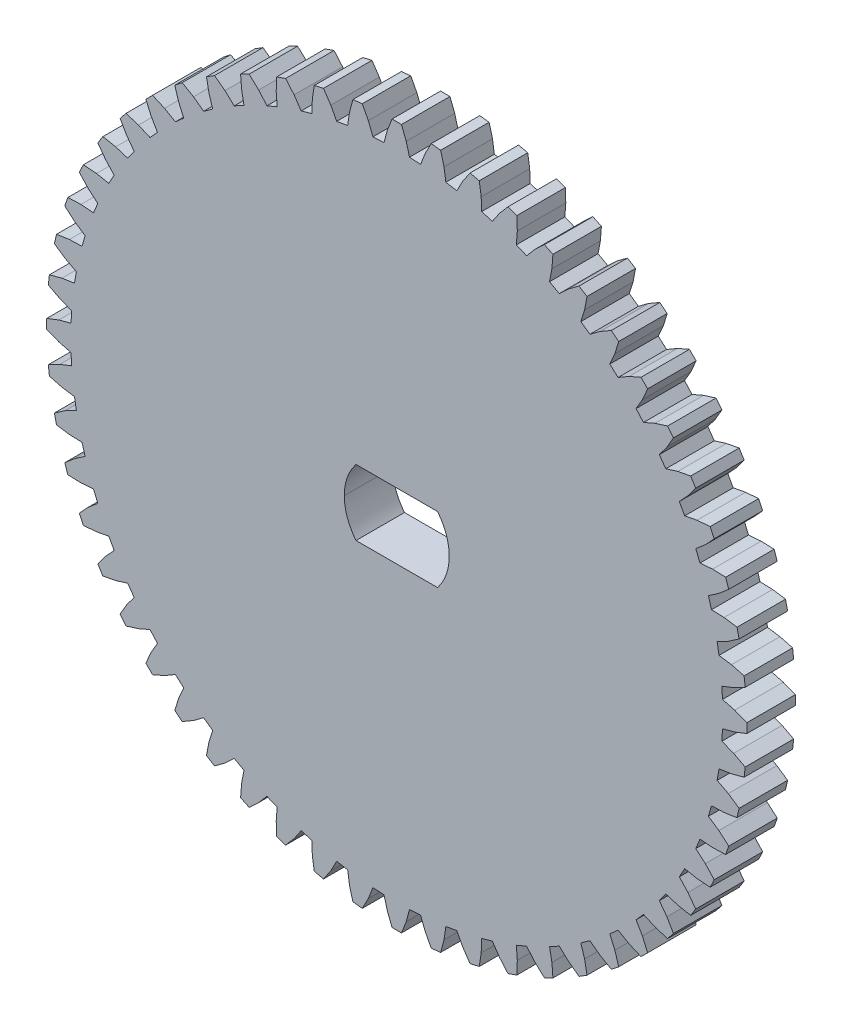
from build123d import *

# Parameters (mm, degrees)
BOSS_EXTRUDE1_DEPTH = 3.175


with BuildPart() as part:
    # Model → Boss-Extrude1 (new body)
    with BuildSketch(Plane.XY):
        Polygon((76.096077, 96.406065), (75.297953, 96.61745), (75.257031, 97.346148), (76.026368, 97.645585), (76.783571, 98.044648), (76.714426, 98.659045), (75.887233, 98.879461), (75.070482, 99.000252), (74.94828, 99.719637), (75.679517, 100.103459), (76.387331, 100.58493), (76.249606, 101.187474), (75.403222, 101.31391), (74.578004, 101.342697), (74.375933, 102.043737), (75.059475, 102.507145), (75.708868, 103.064534), (75.50454, 103.64817), (74.649406, 103.678932), (73.826164, 103.61515), (73.547046, 104.289097), (74.174144, 104.826165), (74.757215, 105.452981), (74.488822, 106.009805), (73.635382, 105.944894), (72.824557, 105.789108), (72.47178, 106.427777), (73.034813, 107.03145), (73.543942, 107.719508), (73.215153, 108.24303), (72.374131, 108.082728), (71.585884, 107.837477), (71.16368, 108.432401), (71.655875, 109.095341), (72.084571, 109.836174), (71.699337, 110.319339), (70.88174, 110.066185), (70.125666, 109.73401), (69.63968, 110.277852), (70.054264, 110.991874), (70.397446, 111.77617), (69.960566, 112.21305), (69.176271, 111.869868), (68.462248, 111.455283), (67.918406, 111.94127), (68.250582, 112.697343), (68.503735, 113.514941), (68.020571, 113.900174), (67.279737, 113.471479), (66.616797, 112.979283), (66.021873, 113.401488), (66.267124, 114.189734), (66.427426, 115.030757), (65.903904, 115.359545), (65.215846, 114.850417), (64.612173, 114.287383), (63.973504, 114.640161), (64.129291, 115.450985), (64.194202, 116.304425), (63.637377, 116.572819), (63.010562, 115.989748), (62.473493, 115.36265), (61.799546, 115.641768), (61.863328, 116.46501), (61.832566, 117.320143), (61.248931, 117.524472), (60.691542, 116.875079), (60.228133, 116.191537), (59.527093, 116.393608), (59.498306, 117.218825), (59.371871, 118.06521), (58.769326, 118.202934), (58.287855, 117.495121), (57.904033, 116.763883), (57.184648, 116.886085), (57.063857, 117.702837), (56.843442, 118.53003), (56.229044, 118.599174), (55.829982, 117.841972), (55.530544, 117.072634), (54.801846, 117.113557), (54.590462, 117.911681), (54.278606, 118.708677), (53.66054, 118.708677), (53.348684, 117.911681), (53.1373, 117.113557), (52.408602, 117.072634), (52.109164, 117.841972), (51.710102, 118.599174), (51.095704, 118.53003), (50.875288, 117.702837), (50.754497, 116.886085), (50.035113, 116.763883), (49.651291, 117.495121), (49.16982, 118.202934), (48.567275, 118.06521), (48.44084, 117.218825), (48.412053, 116.393608), (47.711013, 116.191537), (47.247604, 116.875079), (46.690215, 117.524472), (46.10658, 117.320143), (46.075817, 116.46501), (46.1396, 115.641768), (45.465653, 115.36265), (44.928584, 115.989748), (44.301768, 116.572819), (43.744944, 116.304425), (43.809855, 115.450985), (43.965642, 114.640161), (43.326973, 114.287383), (42.7233, 114.850417), (42.035242, 115.359545), (41.51172, 115.030757), (41.672022, 114.189734), (41.917273, 113.401488), (41.322348, 112.979283), (40.659408, 113.471479), (39.918575, 113.900174), (39.435411, 113.514941), (39.688564, 112.697343), (40.02074, 111.94127), (39.476897, 111.455283), (38.762875, 111.869868), (37.97858, 112.21305), (37.5417, 111.77617), (37.884882, 110.991874), (38.299466, 110.277852), (37.81348, 109.73401), (37.057406, 110.066185), (36.239808, 110.319339), (35.854575, 109.836174), (36.283271, 109.095341), (36.775466, 108.432401), (36.353262, 107.837477), (35.565015, 108.082728), (34.723993, 108.24303), (34.395204, 107.719508), (34.904333, 107.03145), (35.467366, 106.427777), (35.114588, 105.789108), (34.303764, 105.944894), (33.450324, 106.009805), (33.181931, 105.452981), (33.765002, 104.826165), (34.3921, 104.289097), (34.112982, 103.61515), (33.28974, 103.678932), (32.434606, 103.64817), (32.230277, 103.064534), (32.879671, 102.507145), (33.563213, 102.043737), (33.361142, 101.342697), (32.535924, 101.31391), (31.68954, 101.187474), (31.551815, 100.58493), (32.259628, 100.103459), (32.990866, 99.719637), (32.868664, 99.000252), (32.051913, 98.879461), (31.22472, 98.659045), (31.155575, 98.044648), (31.912777, 97.645585), (32.682115, 97.346148), (32.641193, 96.61745), (31.843068, 96.406065), (31.046073, 96.09421), (31.046073, 95.476143), (31.843068, 95.164288), (32.641193, 94.952903), (32.682115, 94.224205), (31.912777, 93.924768), (31.155575, 93.525705), (31.22472, 92.911308), (32.051913, 92.690892), (32.868664, 92.570101), (32.990866, 91.850717), (32.259628, 91.466894), (31.551815, 90.985423), (31.68954, 90.382879), (32.535924, 90.256443), (33.361142, 90.227657), (33.563213, 89.526617), (32.879671, 89.063208), (32.230277, 88.505819), (32.434606, 87.922183), (33.28974, 87.891421), (34.112982, 87.955203), (34.3921, 87.281257), (33.765002, 86.744188), (33.181931, 86.117372), (33.450324, 85.560548), (34.303764, 85.625459), (35.114588, 85.781245), (35.467366, 85.142577), (34.904333, 84.538903), (34.395204, 83.850845), (34.723993, 83.327323), (35.565015, 83.487625), (36.353262, 83.732877), (36.775466, 83.137952), (36.283271, 82.475012), (35.854575, 81.734179), (36.239808, 81.251014), (37.057406, 81.504168), (37.81348, 81.836343), (38.299466, 81.292501), (37.884882, 80.578479), (37.5417, 79.794183), (37.97858, 79.357303), (38.762875, 79.700485), (39.476897, 80.11507), (40.02074, 79.629083), (39.688564, 78.87301), (39.435411, 78.055412), (39.918575, 77.670179), (40.659408, 78.098874), (41.322348, 78.59107), (41.917273, 78.168865), (41.672022, 77.380619), (41.51172, 76.539597), (42.035242, 76.210808), (42.7233, 76.719937), (43.326973, 77.28297), (43.965642, 76.930192), (43.809855, 76.119368), (43.744944, 75.265928), (44.301768, 74.997534), (44.928584, 75.580605), (45.465653, 76.207703), (46.1396, 75.928585), (46.075817, 75.105343), (46.10658, 74.25021), (46.690215, 74.045881), (47.247604, 74.695274), (47.711013, 75.378817), (48.412053, 75.176745), (48.44084, 74.351528), (48.567275, 73.505143), (49.16982, 73.367419), (49.651291, 74.075232), (50.035113, 74.80647), (50.754497, 74.684268), (50.875288, 73.867517), (51.095704, 73.040323), (51.710102, 72.971179), (52.109164, 73.728381), (52.408602, 74.497719), (53.1373, 74.456797), (53.348684, 73.658672), (53.66054, 72.861677), (54.278606, 72.861677), (54.590462, 73.658672), (54.801846, 74.456797), (55.530544, 74.497719), (55.829982, 73.728381), (56.229044, 72.971179), (56.843442, 73.040323), (57.063857, 73.867517), (57.184648, 74.684268), (57.904033, 74.80647), (58.287855, 74.075232), (58.769326, 73.367419), (59.371871, 73.505143), (59.498306, 74.351528), (59.527093, 75.176745), (60.228133, 75.378817), (60.691542, 74.695274), (61.248931, 74.045881), (61.832566, 74.25021), (61.863328, 75.105343), (61.799546, 75.928585), (62.473493, 76.207703), (63.010562, 75.580605), (63.637377, 74.997534), (64.194202, 75.265928), (64.129291, 76.119368), (63.973504, 76.930192), (64.612173, 77.28297), (65.215846, 76.719937), (65.903904, 76.210808), (66.427426, 76.539597), (66.267124, 77.380619), (66.021873, 78.168865), (66.616797, 78.59107), (67.279737, 78.098874), (68.020571, 77.670179), (68.503735, 78.055412), (68.250582, 78.87301), (67.918406, 79.629083), (68.462248, 80.11507), (69.176271, 79.700485), (69.960566, 79.357303), (70.397446, 79.794183), (70.054264, 80.578479), (69.63968, 81.292501), (70.125666, 81.836343), (70.88174, 81.504168), (71.699337, 81.251014), (72.084571, 81.734179), (71.655875, 82.475012), (71.16368, 83.137952), (71.585884, 83.732877), (72.374131, 83.487625), (73.215153, 83.327323), (73.543942, 83.850845), (73.034813, 84.538903), (72.47178, 85.142577), (72.824557, 85.781245), (73.635382, 85.625459), (74.488822, 85.560548), (74.757215, 86.117372), (74.174144, 86.744188), (73.547046, 87.281257), (73.826164, 87.955203), (74.649406, 87.891421), (75.50454, 87.922183), (75.708868, 88.505819), (75.059475, 89.063208), (74.375933, 89.526617), (74.578004, 90.227657), (75.403222, 90.256443), (76.249606, 90.382879), (76.387331, 90.985423), (75.679517, 91.466894), (74.94828, 91.850717), (75.070482, 92.570101), (75.887233, 92.690892), (76.714426, 92.911308), (76.783571, 93.525705), (76.026368, 93.924768), (75.257031, 94.224205), (75.297953, 94.952903), (76.096077, 95.164288), (76.893073, 95.476143), (76.893073, 96.09421), align=None)
        with BuildLine():
            Line((56.637453, 93.628821), (51.301692, 93.628821))
            add(Edge.make_bspline(
                [(50.534401, 95.789585), (50.534401, 94.971437), (50.824009, 94.218674), (51.301692, 93.628821)],
                knots=[0, 0, 0, 0, 1, 1, 1, 1], degree=3))
            add(Edge.make_bspline(
                [(51.301692, 97.941529), (50.824009, 97.351676), (50.534401, 96.607733), (50.534401, 95.789585)],
                knots=[0, 0, 0, 0, 1, 1, 1, 1], degree=3))
            Line((51.301692, 97.941529), (56.637453, 97.941529))
            add(Edge.make_bspline(
                [(57.404745, 95.789585), (57.404745, 96.607733), (57.115137, 97.351676), (56.637453, 97.941529)],
                knots=[0, 0, 0, 0, 1, 1, 1, 1], degree=3))
            add(Edge.make_bspline(
                [(56.637453, 93.628821), (57.115137, 94.218674), (57.404745, 94.971437), (57.404745, 95.789585)],
                knots=[0, 0, 0, 0, 1, 1, 1, 1], degree=3))
        make_face(mode=Mode.SUBTRACT)
    extrude(amount=BOSS_EXTRUDE1_DEPTH)


solid = part.part
